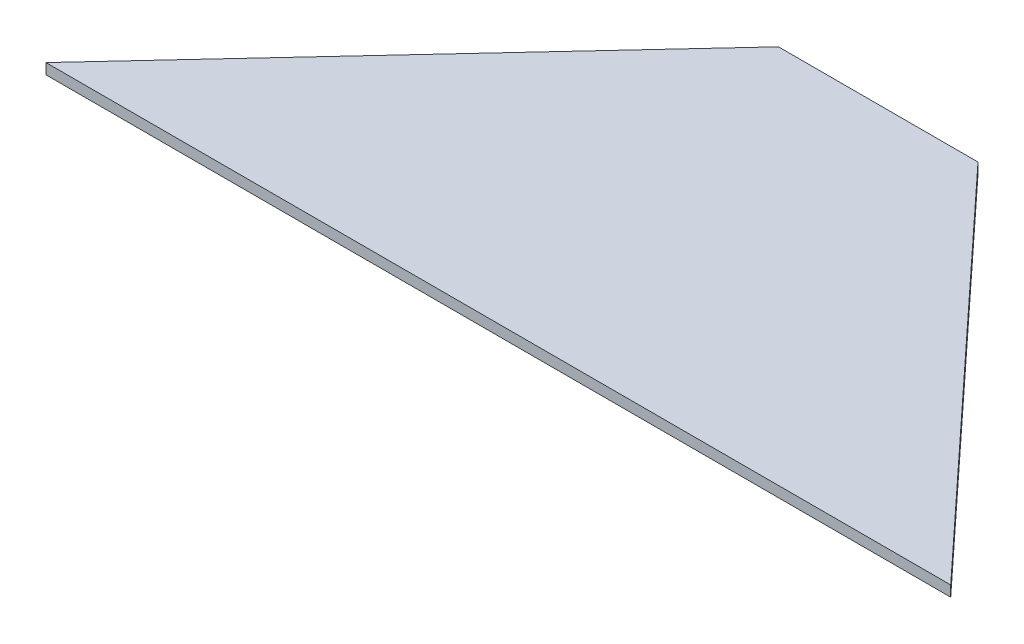
from build123d import *

# Parameters (mm, degrees)
EXTRUDE_1_DEPTH = 4


with BuildPart() as part:
    # Sketch 1 → Бобышка-Вытянуть1 (new body)
    with BuildSketch(Plane(origin=(-117.415970164, 10, -211.118867865), x_dir=(1, 0, 0), z_dir=(0, 1, 0))):
        Polygon((0, 0), (340, 0), (207.5, 142.762020328), (132.5, 142.762020328), align=None)
    extrude(amount=EXTRUDE_1_DEPTH)


solid = part.part
